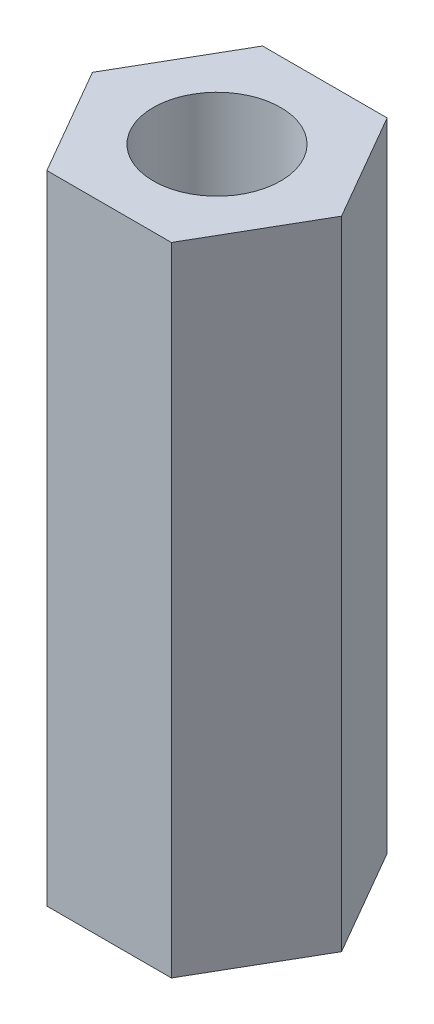
from build123d import *

# Parameters (mm, degrees)
SKETCH1_R           = 1.5
BOSS_EXTRUDE1_DEPTH = 15


with BuildPart() as part:
    # Sketch1 → Boss-Extrude1 (new body)
    with BuildSketch(Plane(origin=(0, 0, 0), x_dir=(1, 0, 0), z_dir=(0, 1, 0))):
        Polygon((1.466469684, 2.54), (-1.466469684, 2.54), (-2.932939367, 0), (-1.466469684, -2.54), (1.466469684, -2.54), (2.932939367, 0), align=None)
        with Locations(Location((0, 0, 0), (0, 0, 270))):
            Circle(SKETCH1_R, mode=Mode.SUBTRACT)
    extrude(amount=BOSS_EXTRUDE1_DEPTH)


solid = part.part
